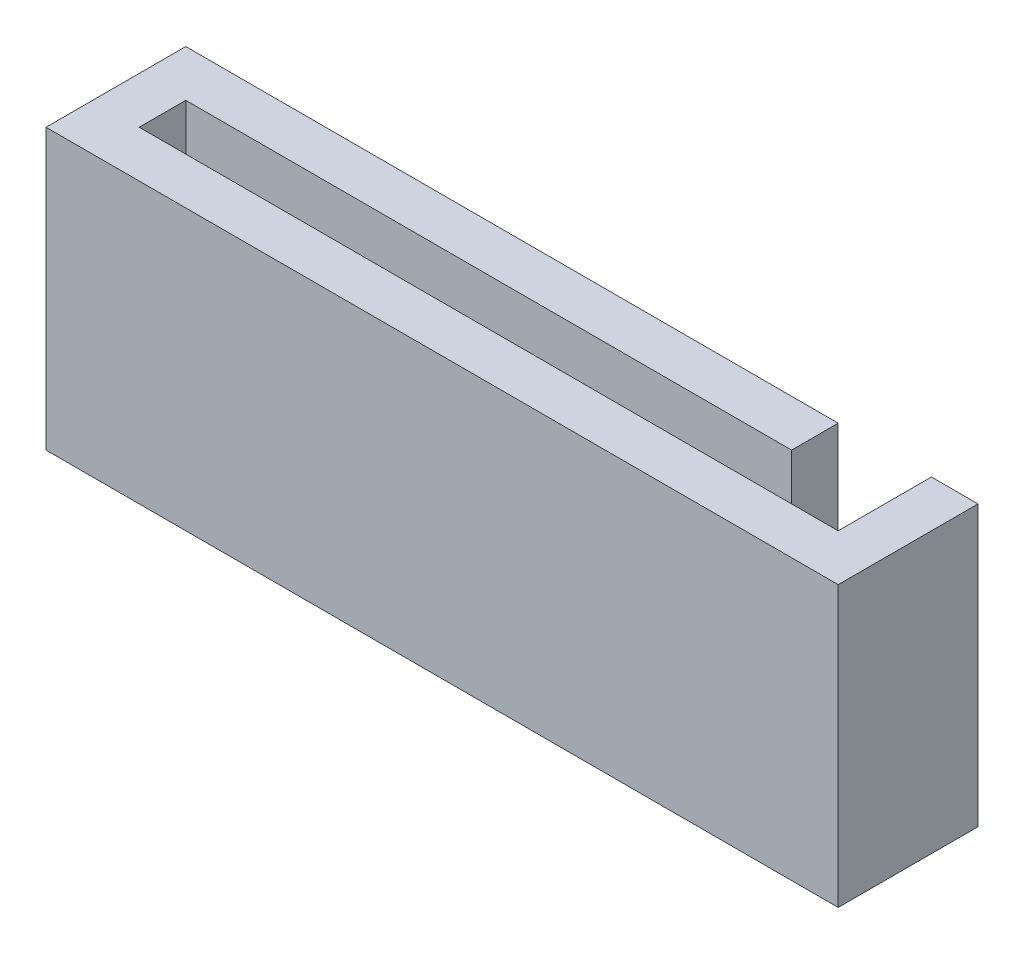
from build123d import *

# Parameters (mm, degrees)
BOSS_EXTRUDE1_DEPTH = 6
BOSS_EXTRUDE2_DEPTH = 1


with BuildPart() as part:
    # Sketch1 → Boss-Extrude1 (new body)
    with BuildSketch(Plane(origin=(0, 0, 0), x_dir=(1, 0, 0), z_dir=(0, 1, 0))):
        Polygon((0, 0), (0, 3), (-1, 3), (-1, 1), (-16, 1), (-16, 2), (-3, 2), (-3, 3), (-17, 3), (-17, 0), align=None)
    extrude(amount=BOSS_EXTRUDE1_DEPTH)

    # Sketch1<3> → Boss-Extrude2 (add)
    with BuildSketch(Plane(origin=(0, 0, 0), x_dir=(1, 0, 0), z_dir=(0, 1, 0))):
        Polygon((-16, 1), (-1, 1), (-1, 3), (-3, 3), (-3, 2), (-16, 2), align=None)
    extrude(amount=BOSS_EXTRUDE2_DEPTH)


solid = part.part
